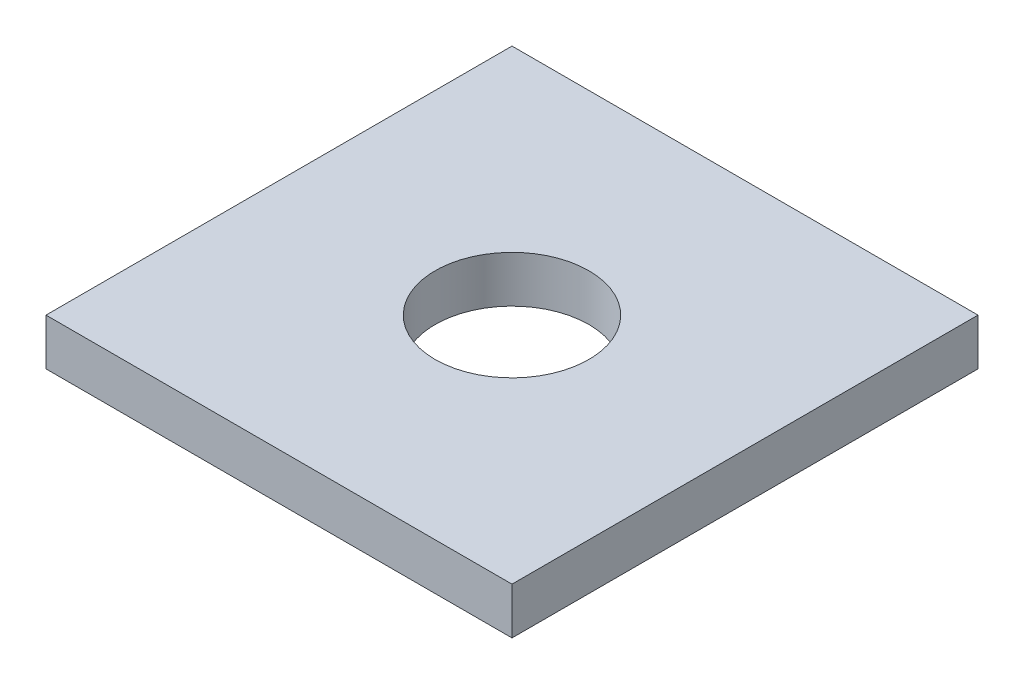
from build123d import *

# Parameters (mm, degrees)
SKETCH1_W           = 100
SKETCH1_H           = 100
SKETCH1_R           = 19
SKETCH1_R_2         = 16.5
BOSS_EXTRUDE1_DEPTH = 10


with BuildPart() as part:
    # Sketch1 → Boss-Extrude1 (new body)
    # profile 1 of 2: a face of its own
    with BuildSketch(Plane(origin=(0, 0, 0), x_dir=(1, 0, 0), z_dir=(0, 1, 0))):
        Rectangle(SKETCH1_W, SKETCH1_H)
        Circle(SKETCH1_R, mode=Mode.SUBTRACT)
    # profile 2 of 2: a face of its own
    with BuildSketch(Plane(origin=(0, 0, 0), x_dir=(1, 0, 0), z_dir=(0, 1, 0))):
        Circle(SKETCH1_R)
        with Locations(Location((0, 0, 0), (0, 0, 270))):
            Circle(SKETCH1_R_2, mode=Mode.SUBTRACT)
    extrude(amount=BOSS_EXTRUDE1_DEPTH)


solid = part.part
